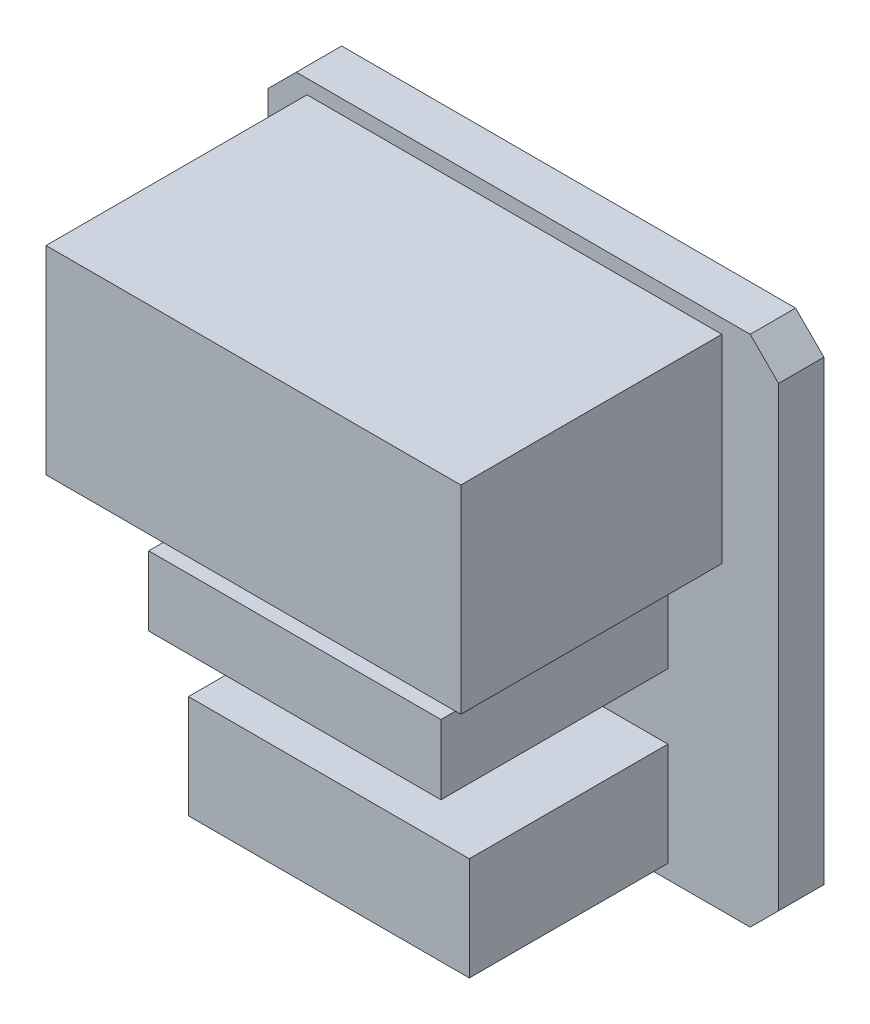
from build123d import *

# Parameters (mm, degrees)
SKETCH1_W           = 18
SKETCH1_H           = 18.1
BOSS_EXTRUDE1_DEPTH = 1.6
CHAMFER1_SIZE       = 1
SKETCH2_W           = 9.9
SKETCH2_H           = 3.64
BOSS_EXTRUDE2_DEPTH = 7
SKETCH3_W           = 10.3
SKETCH3_H           = 2.45
BOSS_EXTRUDE3_DEPTH = 8
SKETCH4_W           = 14.62
SKETCH4_H           = 7
BOSS_EXTRUDE4_DEPTH = 9.2


with BuildPart() as part:
    # Sketch1 → Boss-Extrude1 (new body)
    with BuildSketch(Plane.XY):
        with Locations((9, 9.05)):
            Rectangle(SKETCH1_W, SKETCH1_H)
    extrude(amount=BOSS_EXTRUDE1_DEPTH)

    # Chamfer1
    chamfer1_edges = [part.edges().sort_by_distance(p)[0] for p in [
        (0, 18.1, 0.8),
        (18, 18.1, 0.8),
        (18, 0, 0.8),
        (0, 0, 0.8),
    ]]
    chamfer(chamfer1_edges, length=CHAMFER1_SIZE)

    # Sketch2 → Boss-Extrude2 (add)
    with BuildSketch(Plane.XY.offset(1.6)):
        with Locations((9.15, 2.32)):
            Rectangle(SKETCH2_W, SKETCH2_H)
    extrude(amount=BOSS_EXTRUDE2_DEPTH)

    # Sketch3 → Boss-Extrude3 (add)
    with BuildSketch(Plane.XY.offset(1.6)):
        with Locations((8.95, 7.665)):
            Rectangle(SKETCH3_W, SKETCH3_H)
    extrude(amount=BOSS_EXTRUDE3_DEPTH)

    # Sketch4 → Boss-Extrude4 (add)
    with BuildSketch(Plane.XY.offset(1.6)):
        with Locations((8.69, 14.1)):
            Rectangle(SKETCH4_W, SKETCH4_H)
    extrude(amount=BOSS_EXTRUDE4_DEPTH)


solid = part.part
